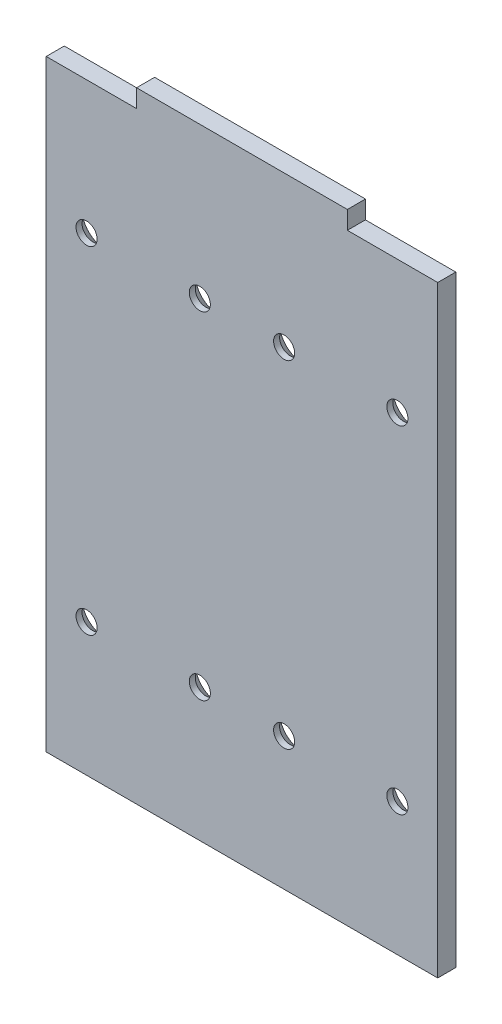
from build123d import *

# Parameters (mm, degrees)
SKETCH_1_W          = 35
SKETCH_1_H          = 3
EXTRUDE_1_DEPTH     = 3
SKETCH_2_R          = 1.75
CUT_EXTRUDE_1_DEPTH = 10
CHAMFER_1_SIZE      = 2


with BuildPart() as part:
    # Эскиз1 → Бобышка-Вытянуть1 (new body)
    with BuildSketch(Plane.XY):
        Polygon((-32.5, 50), (-32.5, -50), (32.5, -50), (32.5, 50), (17.5, 50), (17.5, 47), (-17.5, 47), (-17.5, 50), align=None)
        with Locations((0, 48.5)):
            Rectangle(SKETCH_1_W, SKETCH_1_H)
        with Locations((0, 51.5)):
            Rectangle(SKETCH_1_W, SKETCH_1_H)
    extrude(amount=EXTRUDE_1_DEPTH)

    # Эскиз2 → Вырез-Вытянуть1 (cut)
    with BuildSketch(Plane.XY.offset(3)):
        with Locations((-25.8, 27.95)):
            Circle(SKETCH_2_R)
        with Locations((-7, 27.95)):
            Circle(SKETCH_2_R)
        with Locations((7, 27.95)):
            Circle(SKETCH_2_R)
        with Locations((25.8, 27.95)):
            Circle(SKETCH_2_R)
        with Locations((-25.8, -27.95)):
            Circle(SKETCH_2_R)
        with Locations((-7, -27.95)):
            Circle(SKETCH_2_R)
        with Locations((7, -27.95)):
            Circle(SKETCH_2_R)
        with Locations((25.8, -27.95)):
            Circle(SKETCH_2_R)
    extrude(amount=-CUT_EXTRUDE_1_DEPTH, mode=Mode.SUBTRACT)

    # Фаска1
    chamfer_1_edges = [part.edges().sort_by_distance(p)[0] for p in [
        (-27.55, -27.95, 0),
        (24.05, 27.95, 0),
        (5.25, 27.95, 0),
        (-8.75, 27.95, 0),
        (-8.75, -27.95, 0),
        (5.25, -27.95, 0),
        (24.05, -27.95, 0),
        (-27.55, 27.95, 0),
    ]]
    chamfer(chamfer_1_edges, length=CHAMFER_1_SIZE)


solid = part.part
